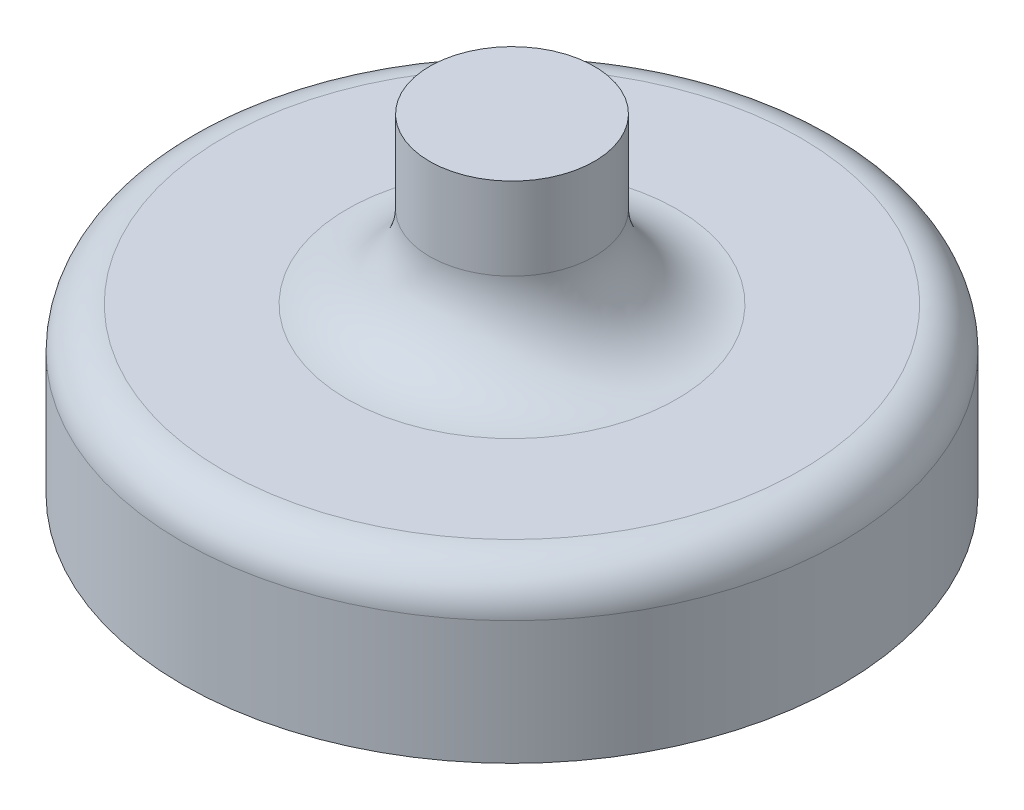
from build123d import *

# Parameters (mm, degrees)
SKETCH1_R           = 50.8
BOSS_EXTRUDE1_DEPTH = 25.4
SKETCH2_R           = 12.7
BOSS_EXTRUDE2_DEPTH = 25.4
FILLET5_R           = 12.7
FILLET6_R           = 6.35


with BuildPart() as part:
    # Sketch1 → Boss-Extrude1 (new body)
    with BuildSketch(Plane(origin=(0, 0, 0), x_dir=(1, 0, 0), z_dir=(0, 1, 0))):
        with Locations(Location((0, 0, 0), (0, 0, 270))):
            Circle(SKETCH1_R)
    extrude(amount=BOSS_EXTRUDE1_DEPTH)

    # Sketch2 → Boss-Extrude2 (add)
    with BuildSketch(Plane(origin=(0, 25.4, 0), x_dir=(1, 0, 0), z_dir=(0, 1, 0))):
        with Locations(Location((0, 0, 0), (0, 0, 270))):
            Circle(SKETCH2_R)
    extrude(amount=BOSS_EXTRUDE2_DEPTH)

    # Fillet5
    fillet5_edges = [part.edges().sort_by_distance(p)[0] for p in [
        (0, 25.4, -12.7),
    ]]
    fillet(fillet5_edges, radius=FILLET5_R)

    # Fillet6
    fillet6_edges = [part.edges().sort_by_distance(p)[0] for p in [
        (0, 25.4, -50.8),
    ]]
    fillet(fillet6_edges, radius=FILLET6_R)


solid = part.part
